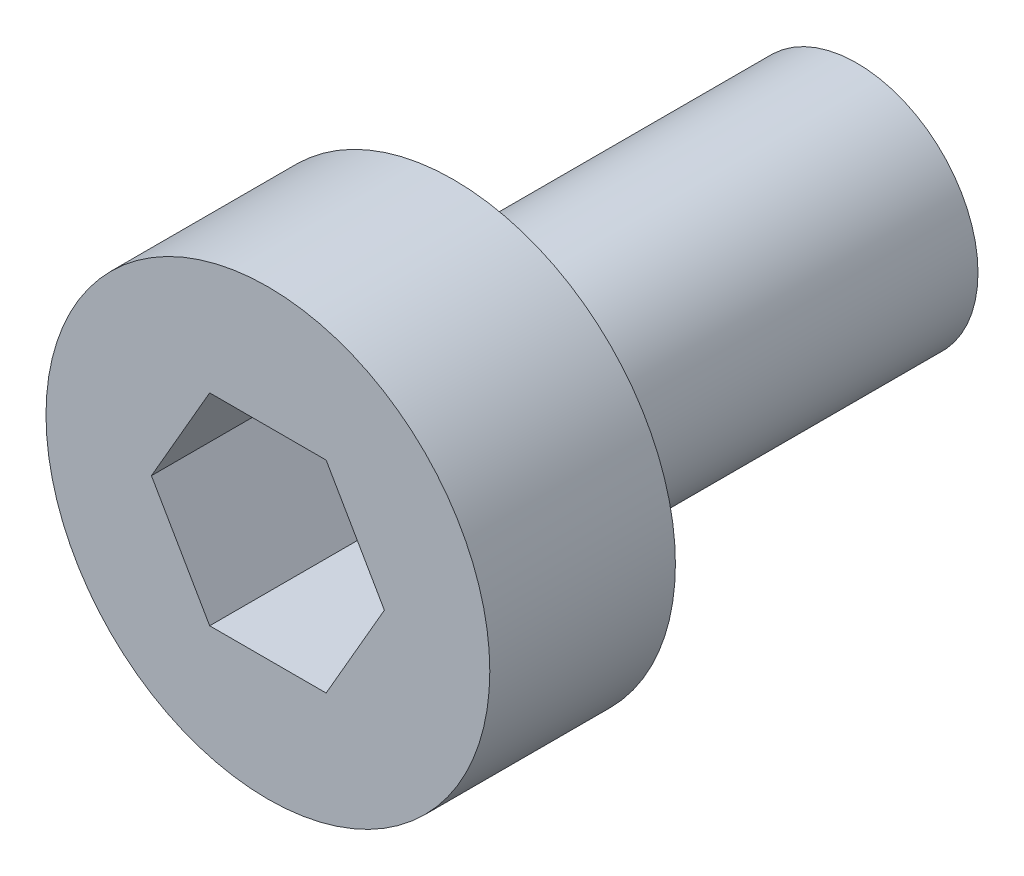
from build123d import *

# Parameters (mm, degrees)
ESQUISSE1_R             = 1.5
BOSS_EXTRU_1_DEPTH      = 5
ESQUISSE2_R             = 2.75
BOSS_EXTRU_2_DEPTH      = 2.3
ENL_V_MAT_EXTRU_1_DEPTH = 2


with BuildPart() as part:
    # Esquisse1 → Boss.-Extru.1 (new body)
    with BuildSketch(Plane.XY):
        Circle(ESQUISSE1_R)
    extrude(amount=BOSS_EXTRU_1_DEPTH)

    # Esquisse2 → Boss.-Extru.2 (add)
    with BuildSketch(Plane.XY.offset(5)):
        Circle(ESQUISSE2_R)
    extrude(amount=BOSS_EXTRU_2_DEPTH)

    # Esquisse3 → Enlèv. mat.-Extru.1 (cut)
    with BuildSketch(Plane.XY.offset(7.3)):
        Polygon((1.443375673, 0), (0.721687836, 1.25), (-0.721687836, 1.25), (-1.443375673, 0), (-0.721687836, -1.25), (0.721687836, -1.25), align=None)
    extrude(amount=-ENL_V_MAT_EXTRU_1_DEPTH, mode=Mode.SUBTRACT)


solid = part.part
